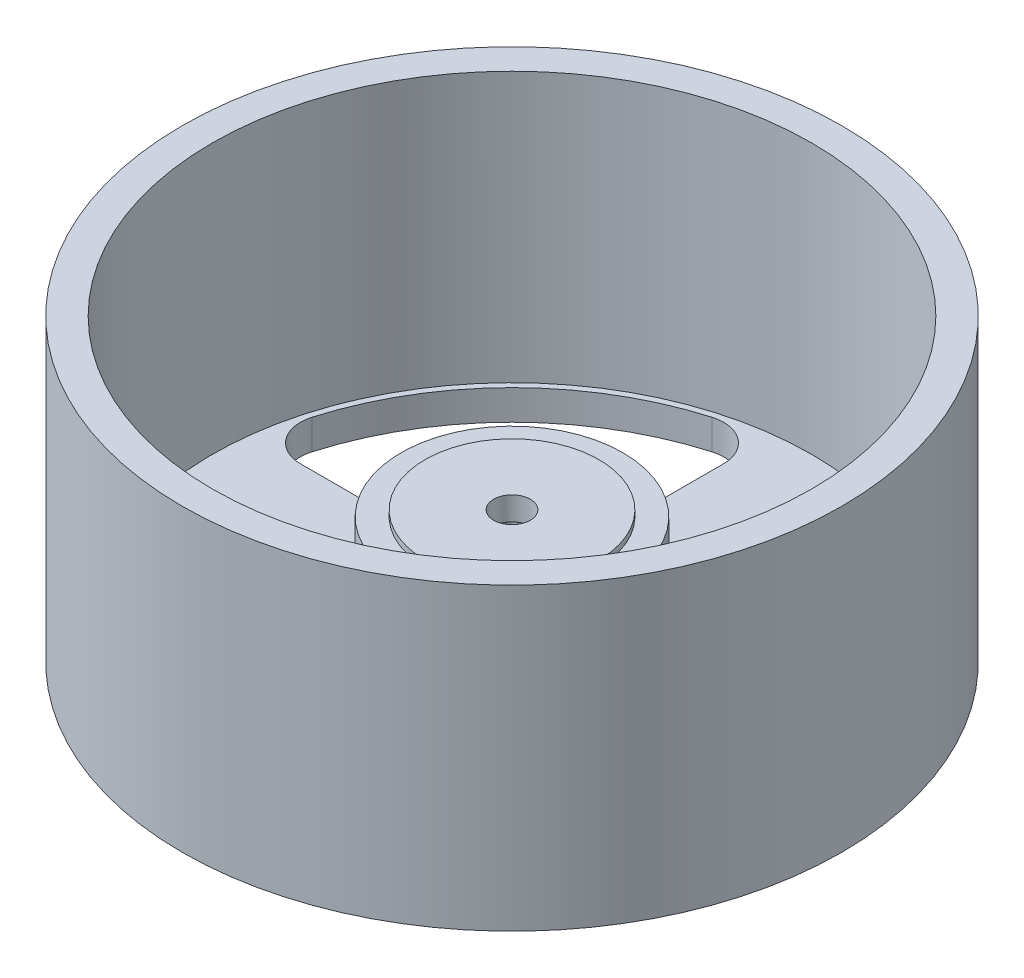
from build123d import *

# Parameters (mm, degrees)
SKETCH1_R           = 27.5
SKETCH1_R_2         = 25
BOSS_EXTRUDE1_DEPTH = 25
SKETCH2_R           = 25
BOSS_EXTRUDE2_DEPTH = 2.5
BOSS_EXTRUDE3_START = 0.5
SKETCH3_R           = 7.25
BOSS_EXTRUDE3_DEPTH = 8
SKETCH3_3_R         = 9.25
SKETCH3_3_R_2       = 7.25
BOSS_EXTRUDE4_DEPTH = 8
SKETCH4_R           = 7.25
CUT_EXTRUDE1_DEPTH  = 3
CUT_EXTRUDE3_DEPTH  = 6
CUT_EXTRUDE5_DEPTH  = 6.05
SKETCH7_R           = 1.525
CUT_EXTRUDE6_DEPTH  = 6.05


with BuildPart() as part:
    # Sketch1 → Boss-Extrude1 (new body)
    with BuildSketch(Plane(origin=(0, 0, 0), x_dir=(1, 0, 0), z_dir=(0, 1, 0))):
        Circle(SKETCH1_R)
        Circle(SKETCH1_R_2, mode=Mode.SUBTRACT)
    extrude(amount=BOSS_EXTRUDE1_DEPTH)

    # Sketch2 → Boss-Extrude2 (add)
    with BuildSketch(Plane.XZ):
        Circle(SKETCH2_R)
    extrude(amount=-BOSS_EXTRUDE2_DEPTH)



with BuildPart() as body_2:
    # Sketch3 → Boss-Extrude3 (new body)
    with BuildSketch(Plane(origin=(0, 2.5, 0), x_dir=(1, 0, 0), z_dir=(0, 1, 0)).offset(BOSS_EXTRUDE3_START)):
        Circle(SKETCH3_R)
    extrude(amount=BOSS_EXTRUDE3_DEPTH)


with BuildPart() as part_1:
    add(part.part)

    add(body_2.part)  # Boss-Extrude4 merges body 2
    # Sketch3<3> → Boss-Extrude4 (add)
    with BuildSketch(Plane(origin=(0, 2.5, 0), x_dir=(1, 0, 0), z_dir=(0, 1, 0))):
        Circle(SKETCH3_3_R)
        Circle(SKETCH3_3_R_2, mode=Mode.SUBTRACT)
    extrude(amount=BOSS_EXTRUDE4_DEPTH)

    # Sketch4 → Cut-Extrude1 (cut)
    with BuildSketch(Plane.XZ):
        Circle(SKETCH4_R)
    extrude(amount=-CUT_EXTRUDE1_DEPTH, mode=Mode.SUBTRACT)

    # Sketch5 → Cut-Extrude3 (cut)
    with BuildSketch(Plane.XZ):
        with BuildLine():
            Line((11.813657351, -3), (20.645822822, -3))
            ThreePointArc((20.645822822, -3), (23.044950571, -4.198837585), (23.526635309, -6.837209302))
            ThreePointArc((23.526635309, -6.837209302), (17.324116139, -17.324116139), (6.837209302, -23.526635309))
            ThreePointArc((6.837209302, -23.526635309), (4.198837585, -23.044950571), (3, -20.645822822))
            Line((3, -20.645822822), (3, -11.813657351))
            ThreePointArc((3, -11.813657351), (3.443100344, -10.244497018), (4.641509434, -9.138867007))
            ThreePointArc((4.641509434, -9.138867007), (7.247844507, -7.247844507), (9.138867007, -4.641509434))
            ThreePointArc((9.138867007, -4.641509434), (10.244497018, -3.443100344), (11.813657351, -3))
        make_face()
        with BuildLine():
            Line((-3, -11.813657351), (-3, -20.645822822))
            ThreePointArc((-3, -20.645822822), (-4.198837585, -23.044950571), (-6.837209302, -23.526635309))
            ThreePointArc((-6.837209302, -23.526635309), (-17.324116139, -17.324116139), (-23.526635309, -6.837209302))
            ThreePointArc((-23.526635309, -6.837209302), (-23.044950571, -4.198837585), (-20.645822822, -3))
            Line((-20.645822822, -3), (-11.813657351, -3))
            ThreePointArc((-11.813657351, -3), (-10.244497018, -3.443100344), (-9.138867007, -4.641509434))
            ThreePointArc((-9.138867007, -4.641509434), (-7.247844507, -7.247844507), (-4.641509434, -9.138867007))
            ThreePointArc((-4.641509434, -9.138867007), (-3.443100344, -10.244497018), (-3, -11.813657351))
        make_face()
        with BuildLine():
            Line((-11.813657351, 3), (-20.645822822, 3))
            ThreePointArc((-20.645822822, 3), (-23.044950571, 4.198837585), (-23.526635309, 6.837209302))
            ThreePointArc((-23.526635309, 6.837209302), (-17.324116139, 17.324116139), (-6.837209302, 23.526635309))
            ThreePointArc((-6.837209302, 23.526635309), (-4.198837585, 23.044950571), (-3, 20.645822822))
            Line((-3, 20.645822822), (-3, 11.813657351))
            ThreePointArc((-3, 11.813657351), (-3.443100344, 10.244497018), (-4.641509434, 9.138867007))
            ThreePointArc((-4.641509434, 9.138867007), (-7.247844507, 7.247844507), (-9.138867007, 4.641509434))
            ThreePointArc((-9.138867007, 4.641509434), (-10.244497018, 3.443100344), (-11.813657351, 3))
        make_face()
        with BuildLine():
            Line((3, 11.813657351), (3, 20.645822822))
            ThreePointArc((3, 20.645822822), (4.198837585, 23.044950571), (6.837209302, 23.526635309))
            ThreePointArc((6.837209302, 23.526635309), (17.324116139, 17.324116139), (23.526635309, 6.837209302))
            ThreePointArc((23.526635309, 6.837209302), (23.044950571, 4.198837585), (20.645822822, 3))
            Line((20.645822822, 3), (11.813657351, 3))
            ThreePointArc((11.813657351, 3), (10.244497018, 3.443100344), (9.138867007, 4.641509434))
            ThreePointArc((9.138867007, 4.641509434), (7.247844507, 7.247844507), (4.641509434, 9.138867007))
            ThreePointArc((4.641509434, 9.138867007), (3.443100344, 10.244497018), (3, 11.813657351))
        make_face()
    extrude(amount=-CUT_EXTRUDE3_DEPTH, mode=Mode.SUBTRACT)

    # Sketch6 → Cut-Extrude5 (cut)
    with BuildSketch(Plane.XZ.offset(-3)):
        with BuildLine():
            ThreePointArc((-3, -2.5), (-3.353553391, -3.353553391), (-2.5, -3))
            Line((-2.5, -3), (3, -3))
            Line((3, -3), (3, 2.5))
            ThreePointArc((3, 2.5), (3.353553391, 3.353553391), (2.5, 3))
            Line((2.5, 3), (-3, 3))
            Line((-3, 3), (-3, -2.5))
        make_face()
    extrude(amount=-CUT_EXTRUDE5_DEPTH, mode=Mode.SUBTRACT)

    # Sketch7 → Cut-Extrude6 (cut)
    with BuildSketch(Plane.XZ.offset(-9.05)):
        Circle(SKETCH7_R)
    extrude(amount=-CUT_EXTRUDE6_DEPTH, mode=Mode.SUBTRACT)


solid = part_1.part
